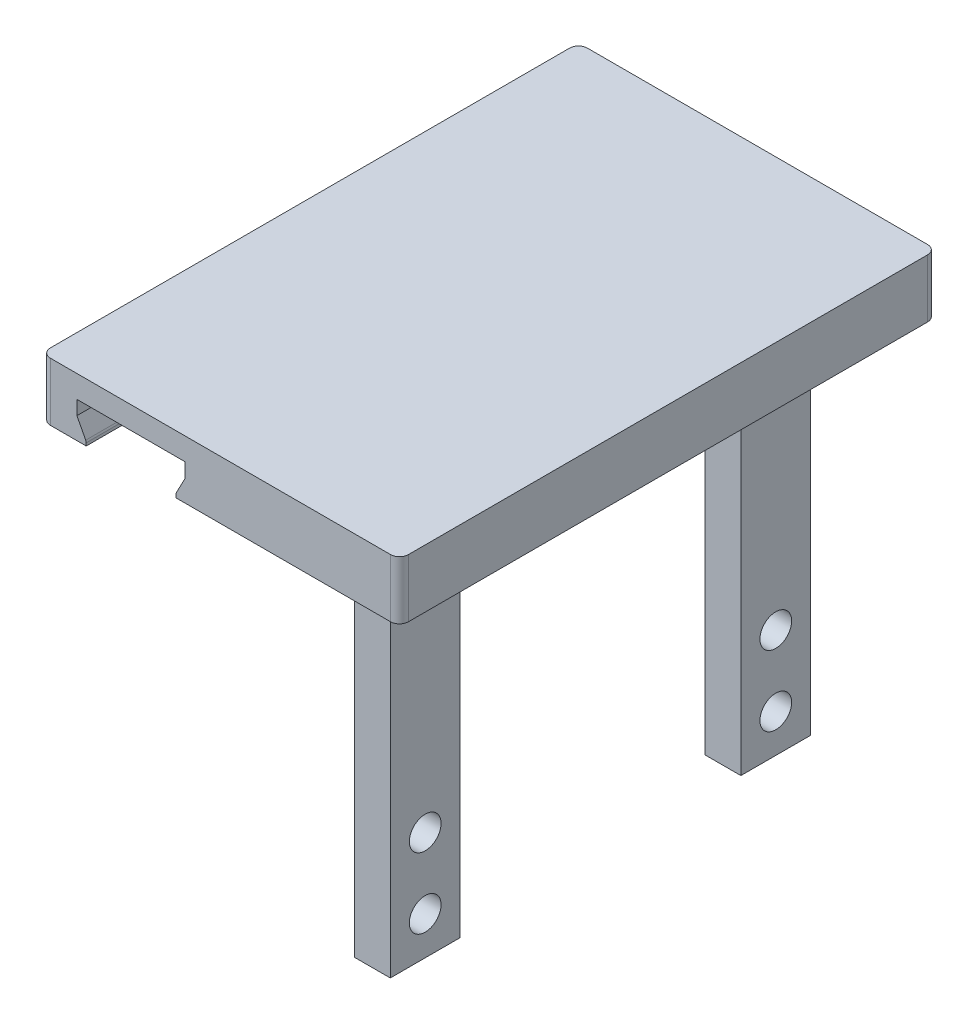
from build123d import *

# Parameters (mm, degrees)
SKETCH2_W           = 50.8
SKETCH2_H           = 76.2
BOSS_EXTRUDE1_DEPTH = 3.175
SKETCH2_5_W         = 6.35
SKETCH2_5_H         = 76.2
SKETCH2_5_W_2       = 5.08
SKETCH2_5_H_2       = 9.906
BOSS_EXTRUDE2_DEPTH = 5.08
SKETCH2_6_W         = 5.08
SKETCH2_6_H         = 9.906
BOSS_EXTRUDE3_DEPTH = 57.15
SKETCH4_R           = 2.249999945
CUT_EXTRUDE1_DEPTH  = 50.8
FILLET1_R           = 1.27
CUT_EXTRUDE2_DEPTH  = 101.6
FILLET2_R           = 0.635


with BuildPart() as part:
    # Sketch2 → Boss-Extrude1 (new body)
    with BuildSketch(Plane(origin=(0, 0, 0), x_dir=(1, 0, 0), z_dir=(0, 1, 0))):
        with Locations((25.4, -38.1)):
            Rectangle(SKETCH2_W, SKETCH2_H)
    extrude(amount=BOSS_EXTRUDE1_DEPTH)

    # Sketch2<5> → Boss-Extrude2 (add)
    # profile 1 of 2: a face of its own
    with BuildSketch(Plane(origin=(0, 0, 0), x_dir=(1, 0, 0), z_dir=(0, 1, 0))):
        with Locations((3.175, -38.1)):
            Rectangle(SKETCH2_5_W, SKETCH2_5_H)
    # profile 2 of 2: a face of its own
    with BuildSketch(Plane(origin=(0, 0, 0), x_dir=(1, 0, 0), z_dir=(0, 1, 0))):
        Polygon((50.8, 0), (19.0754, 0), (19.0754, -38.1), (19.0754, -76.2), (50.8, -76.2), align=None)
        with Locations((38.678980046, -62.970991406)):
            Rectangle(SKETCH2_5_W_2, SKETCH2_5_H_2, mode=Mode.SUBTRACT)
        with Locations((38.678980046, -13.229008594)):
            Rectangle(SKETCH2_5_W_2, SKETCH2_5_H_2, mode=Mode.SUBTRACT)
    extrude(amount=-BOSS_EXTRUDE2_DEPTH)

    # Sketch2<6> → Boss-Extrude3 (add)
    with BuildSketch(Plane(origin=(0, 0, 0), x_dir=(1, 0, 0), z_dir=(0, 1, 0))):
        with Locations((38.678980046, -13.229008594)):
            Rectangle(SKETCH2_6_W, SKETCH2_6_H)
        with Locations((38.678980046, -62.970991406)):
            Rectangle(SKETCH2_6_W, SKETCH2_6_H)
    extrude(amount=-BOSS_EXTRUDE3_DEPTH)

    # Sketch4 → Cut-Extrude1 (cut)
    with BuildSketch(Plane.ZY.offset(-36.138980046)):
        with Locations((13.229008594, -41.743296244)):
            Circle(SKETCH4_R)
        with Locations((13.229008594, -51.743296056)):
            Circle(SKETCH4_R)
        with Locations((62.970991406, -41.743296244)):
            Circle(SKETCH4_R)
        with Locations((62.970991406, -51.743296056)):
            Circle(SKETCH4_R)
    extrude(amount=-CUT_EXTRUDE1_DEPTH, mode=Mode.SUBTRACT)

    # Fillet1
    fillet1_edges = [part.edges().sort_by_distance(p)[0] for p in [
        (0, -0.9525, 0),
        (0, -0.9525, 76.2),
        (50.8, -0.9525, 76.2),
        (50.8, -0.9525, 0),
        (38.678980046, -5.08, 67.923991406),
        (36.138980046, -5.08, 62.970991406),
        (38.678980046, -5.08, 58.017991406),
        (41.218980046, -5.08, 13.229008594),
        (36.138980046, -5.08, 13.229008594),
        (38.678980046, -5.08, 8.276008594),
        (41.218980046, -5.08, 62.970991406),
        (38.678980046, -5.08, 18.182008594),
    ]]
    fillet(fillet1_edges, radius=FILLET1_R)

    # Sketch5 → Cut-Extrude2 (cut)
    with BuildSketch(Plane(origin=(0, 0, 0), x_dir=(-1, 0, 0), z_dir=(0, 0, -1))):
        Polygon((-19.0754, 0), (-20.3962, 0), (-20.3962, -2.0066), (-19.0754, -4.532028908), align=None)
        Polygon((-5.0292, 0), (-6.35, 0), (-6.35, -4.532028908), (-5.0292, -2.0066), align=None)
    extrude(amount=-CUT_EXTRUDE2_DEPTH, mode=Mode.SUBTRACT)

    # Fillet2
    fillet2_edges = [part.edges().sort_by_distance(p)[0] for p in [
        (19.0754, -4.532028908, 38.1),
        (6.35, -4.532028908, 38.1),
    ]]
    fillet(fillet2_edges, radius=FILLET2_R)


solid = part.part
